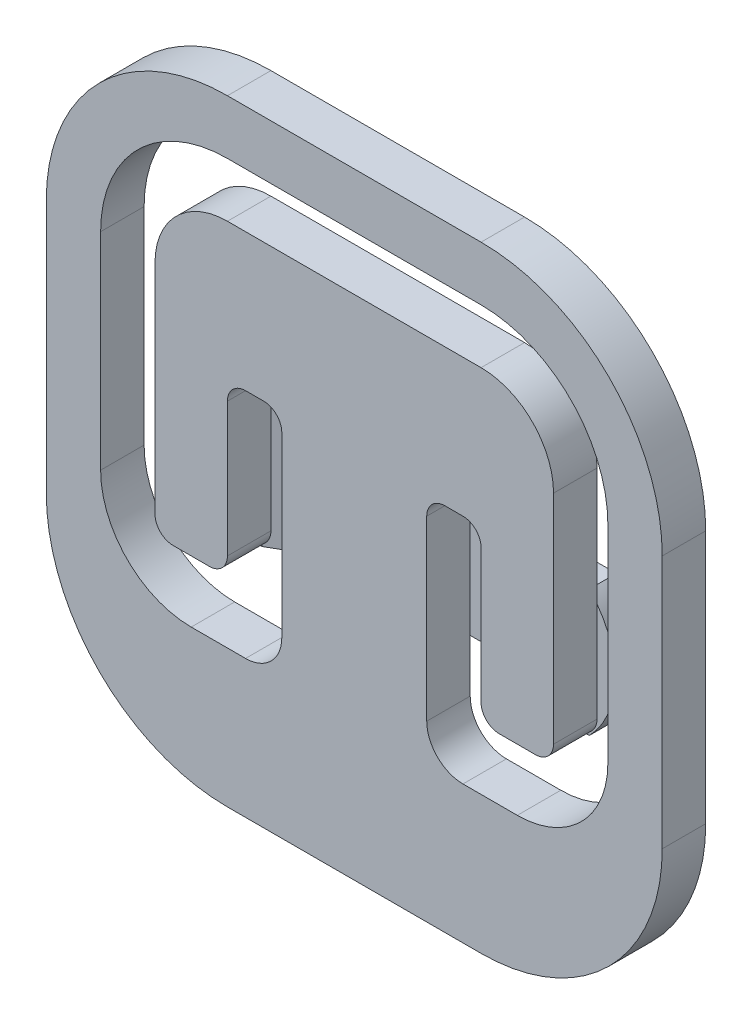
from build123d import *

# Parameters (mm, degrees)
BOSS_EXTRUDE2_DEPTH     = 1.2
BOSS_EXTRUDE3_DEPTH     = 5
CUT_EXTRUDE1_DEPTH      = 25.828209762
CUT_EXTRUDE1_DEPTH_BACK = 25.828209762


with BuildPart() as part:
    # Sketch1 → Boss-Extrude2 (new, symmetric)
    with BuildSketch(Plane.XY):
        with BuildLine():
            ThreePointArc((7, 17), (14.071067812, 14.071067812), (17, 7))
            Line((17, 7), (17, -7))
            ThreePointArc((17, -7), (14.071067812, -14.071067812), (7, -17))
            Line((7, -17), (-7, -17))
            ThreePointArc((-7, -17), (-14.071067812, -14.071067812), (-17, -7))
            Line((-17, -7), (-17, 7))
            ThreePointArc((-17, 7), (-14.071067812, 14.071067812), (-7, 17))
            Line((-7, 17), (7, 17))
        make_face()
        with BuildLine():
            Line((-7, 14), (7, 14))
            ThreePointArc((7, 14), (11.949747468, 11.949747468), (14, 7))
            Line((14, 7), (14, -4.4))
            ThreePointArc((14, -4.4), (12.535533906, -7.935533906), (9, -9.4))
            Line((9, -9.4), (6, -9.4))
            ThreePointArc((6, -9.4), (4.585786438, -8.814213562), (4, -7.4))
            Line((4, -7.4), (4, 2.4))
            ThreePointArc((4, 2.4), (4.292893219, 3.107106781), (5, 3.4))
            Line((5, 3.4), (6, 3.4))
            ThreePointArc((6, 3.4), (6.707106781, 3.107106781), (7, 2.4))
            Line((7, 2.4), (7, -5))
            ThreePointArc((7, -5), (7.292893219, -5.707106781), (8, -6))
            Line((8, -6), (10, -6))
            ThreePointArc((10, -6), (10.707106781, -5.707106781), (11, -5))
            Line((11, -5), (11, 7))
            ThreePointArc((11, 7), (9.828427125, 9.828427125), (7, 11))
            Line((7, 11), (-7, 11))
            ThreePointArc((-7, 11), (-9.828427125, 9.828427125), (-11, 7))
            Line((-11, 7), (-11, -5))
            ThreePointArc((-11, -5), (-10.707106781, -5.707106781), (-10, -6))
            Line((-10, -6), (-8, -6))
            ThreePointArc((-8, -6), (-7.292893219, -5.707106781), (-7, -5))
            Line((-7, -5), (-7, 2.4))
            ThreePointArc((-7, 2.4), (-6.707106781, 3.107106781), (-6, 3.4))
            Line((-6, 3.4), (-5, 3.4))
            ThreePointArc((-5, 3.4), (-4.292893219, 3.107106781), (-4, 2.4))
            Line((-4, 2.4), (-4, -7.4))
            ThreePointArc((-4, -7.4), (-4.585786438, -8.814213562), (-6, -9.4))
            Line((-6, -9.4), (-9, -9.4))
            ThreePointArc((-9, -9.4), (-12.535533906, -7.935533906), (-14, -4.4))
            Line((-14, -4.4), (-14, 7))
            ThreePointArc((-14, 7), (-11.949747468, 11.949747468), (-7, 14))
        make_face(mode=Mode.SUBTRACT)
    extrude(amount=BOSS_EXTRUDE2_DEPTH, both=True)

    # Sketch2 → Boss-Extrude3 (add)
    with BuildSketch(Plane(origin=(0, 0, -1.2), x_dir=(-1, 0, 0), z_dir=(0, 0, -1))):
        with BuildLine():
            Line((-10.570714214, -6), (10.570714214, -6))
            ThreePointArc((10.570714214, -6), (12, -2.5), (10.570714214, 1))
            Line((10.570714214, 1), (-10.570714214, 1))
            ThreePointArc((-10.570714214, 1), (-12, -2.5), (-10.570714214, -6))
        make_face()
    extrude(amount=BOSS_EXTRUDE3_DEPTH)

    # Sketch3 → Cut-Extrude1 (cut, two sides: drawn at the far end of the back side and taken through both)
    with BuildSketch(Plane(origin=(0, 0, 0), x_dir=(1, 0, 0), z_dir=(0, 1, 0)).offset(-CUT_EXTRUDE1_DEPTH_BACK)):
        Polygon((-4.901923789, 4.2), (-7.5, 2.7), (-12, 2.7), (-15.905472788, 2.7), (-15.905472788, 4.2), (-15.905472788, 10.094032112), (14.61063782, 10.094032112), (14.61063782, 4.2), (14.61063782, 2.7), (12, 2.7), (7.5, 2.7), (4.901923789, 4.2), align=None)
        Polygon((4.901923789, 2.7), (-4.901923789, 2.7), (-7.5, 1.2), (7.5, 1.2), align=None)
    extrude(amount=CUT_EXTRUDE1_DEPTH + CUT_EXTRUDE1_DEPTH_BACK, mode=Mode.SUBTRACT)


solid = part.part
